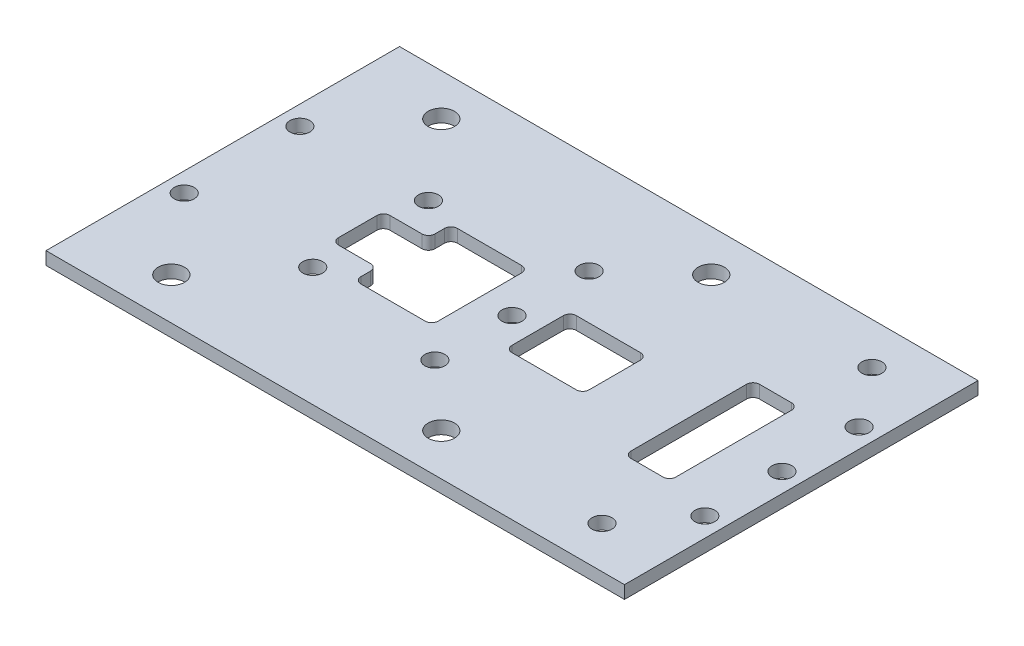
from build123d import *

# Parameters (mm, degrees)
SKETCH_1_W          = 90
SKETCH_1_H          = 55
EXTRUDE_1_DEPTH     = 2
SKETCH_2_R          = 1.55
CUT_EXTRUDE_1_DEPTH = 2
SKETCH_3_R          = 1.55
CUT_EXTRUDE_2_DEPTH = 10
SKETCH_4_R          = 2.05
CUT_EXTRUDE_3_DEPTH = 10
SKETCH_5_R          = 1.55
CUT_EXTRUDE_4_DEPTH = 10
SKETCH_6_W          = 7
SKETCH_6_H          = 20
CUT_EXTRUDE_5_DEPTH = 10
SKETCH_7_W          = 12
SKETCH_7_H          = 15
CUT_EXTRUDE_6_DEPTH = 10
SKETCH_8_W          = 7
SKETCH_8_H          = 8
SKETCH_8_W_2        = 12
SKETCH_8_H_2        = 10
CUT_EXTRUDE_7_DEPTH = 10
FILLET_1_R          = 1


with BuildPart() as part:
    # 草图1 → 凸台-拉伸1 (new body)
    with BuildSketch(Plane(origin=(0, 0, 0), x_dir=(1, 0, 0), z_dir=(0, 1, 0))):
        Rectangle(SKETCH_1_W, SKETCH_1_H)
    extrude(amount=EXTRUDE_1_DEPTH)

    # 草图2 → 切除-拉伸1 (cut)
    with BuildSketch(Plane(origin=(0, 2, 0), x_dir=(1, 0, 0), z_dir=(0, 1, 0))):
        with Locations(Location((0, -12, 0), (0, 0, 270))):
            Circle(SKETCH_2_R)
        with Locations(Location((0, 12, 0), (0, 0, 90))):
            Circle(SKETCH_2_R)
        with Locations(Location((0, 0, 0), (0, 0, 270))):
            Circle(SKETCH_2_R)
        with Locations(Location((42, 12, 0), (0, 0, 270))):
            Circle(SKETCH_2_R)
        with Locations(Location((42, 0, 0), (0, 0, 270))):
            Circle(SKETCH_2_R)
        with Locations(Location((42, -12, 0), (0, 0, 90))):
            Circle(SKETCH_2_R)
    extrude(amount=-CUT_EXTRUDE_1_DEPTH, mode=Mode.SUBTRACT)

    # 草图3 → 切除-拉伸2 (cut)
    with BuildSketch(Plane(origin=(0, 2, 0), x_dir=(1, 0, 0), z_dir=(0, 1, 0))):
        with Locations(Location((35, 21, 0), (0, 0, 270))):
            Circle(SKETCH_3_R)
        with Locations(Location((35, -21, 0), (0, 0, 270))):
            Circle(SKETCH_3_R)
    extrude(amount=-CUT_EXTRUDE_2_DEPTH, mode=Mode.SUBTRACT)

    # 草图4 → 切除-拉伸3 (cut)
    with BuildSketch(Plane(origin=(0, 2, 0), x_dir=(1, 0, 0), z_dir=(0, 1, 0))):
        with Locations(Location((-32, 21, 0), (0, 0, 270))):
            Circle(SKETCH_4_R)
        with Locations(Location((-32, -21, 0), (0, 0, 270))):
            Circle(SKETCH_4_R)
        with Locations(Location((10, 21, 0), (0, 0, 270))):
            Circle(SKETCH_4_R)
        with Locations(Location((10, -21, 0), (0, 0, 270))):
            Circle(SKETCH_4_R)
    extrude(amount=-CUT_EXTRUDE_3_DEPTH, mode=Mode.SUBTRACT)

    # 草图5 → 切除-拉伸4 (cut)
    with BuildSketch(Plane(origin=(0, 2, 0), x_dir=(1, 0, 0), z_dir=(0, 1, 0))):
        with Locations(Location((-42, 9, 0), (0, 0, 270))):
            Circle(SKETCH_5_R)
        with Locations(Location((-42, -9, 0), (0, 0, 270))):
            Circle(SKETCH_5_R)
        with Locations(Location((-22, -9, 0), (0, 0, 270))):
            Circle(SKETCH_5_R)
        with Locations(Location((-22, 9, 0), (0, 0, 270))):
            Circle(SKETCH_5_R)
    extrude(amount=-CUT_EXTRUDE_4_DEPTH, mode=Mode.SUBTRACT)

    # 草图6 → 切除-拉伸5 (cut)
    with BuildSketch(Plane(origin=(0, 2, 0), x_dir=(1, 0, 0), z_dir=(0, 1, 0))):
        with Locations((31, 0)):
            Rectangle(SKETCH_6_W, SKETCH_6_H)
    extrude(amount=-CUT_EXTRUDE_5_DEPTH, mode=Mode.SUBTRACT)

    # 草图7 → 切除-拉伸6 (cut)
    with BuildSketch(Plane(origin=(0, 2, 0), x_dir=(1, 0, 0), z_dir=(0, 1, 0))):
        with Locations((-11, 0)):
            Rectangle(SKETCH_7_W, SKETCH_7_H)
    extrude(amount=-CUT_EXTRUDE_6_DEPTH, mode=Mode.SUBTRACT)

    # 草图8 → 切除-拉伸7 (cut)
    with BuildSketch(Plane(origin=(0, 2, 0), x_dir=(1, 0, 0), z_dir=(0, 1, 0))):
        with Locations((-20.5, 0)):
            Rectangle(SKETCH_8_W, SKETCH_8_H)
        with Locations((10, 0)):
            Rectangle(SKETCH_8_W_2, SKETCH_8_H_2)
    extrude(amount=-CUT_EXTRUDE_7_DEPTH, mode=Mode.SUBTRACT)

    # 圆角1
    fillet_1_edges = [part.edges().sort_by_distance(p)[0] for p in [
        (27.5, 1, 10),
        (27.5, 1, -10),
        (34.5, 1, -10),
        (34.5, 1, 10),
        (-5, 1, -7.5),
        (-5, 1, 7.5),
        (-17, 1, 7.5),
        (-17, 1, -7.5),
        (-17, 1, -4),
        (-17, 1, 4),
        (-24, 1, 4),
        (-24, 1, -4),
        (16, 1, -5),
        (16, 1, 5),
        (4, 1, 5),
        (4, 1, -5),
    ]]
    fillet(fillet_1_edges, radius=FILLET_1_R)


solid = part.part
